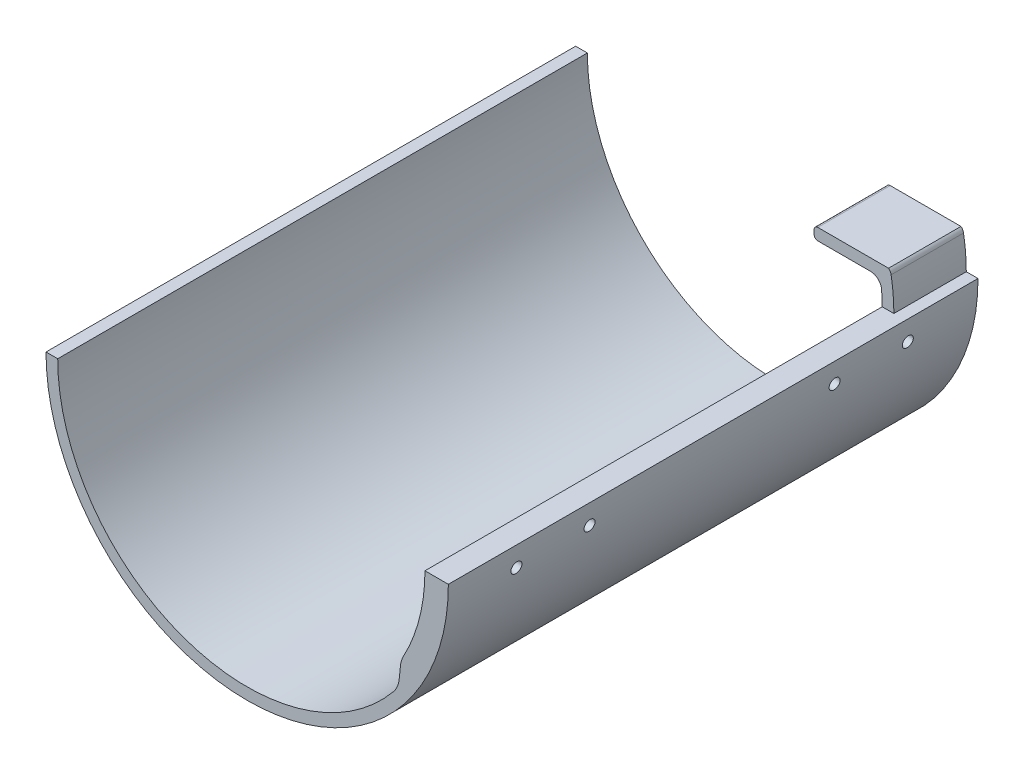
from build123d import *

# Parameters (mm, degrees)
EXTRUDE_1_DEPTH     = 144.8
SKETCH_7_R          = 1.5
CUT_EXTRUDE_6_DEPTH = 80
CUT_EXTRUDE_START   = -125
CUT_EXTRUDE_8_DEPTH = 125


with BuildPart() as part:
    # 草图1 → 凸台-拉伸1 (new body)
    with BuildSketch(Plane.XY):
        with BuildLine():
            Line((-55, 0), (-51.8, 0))
            ThreePointArc((-51.8, 0), (-17.476086779, -48.76296126), (40.00796876, -32.902924425))
            ThreePointArc((40.00796876, -32.902924425), (41.062164054, -31.150956215), (41.565129022, -29.16910189))
            Line((41.565129022, -29.16910189), (41.910264928, -25.795992674))
            ThreePointArc((41.910264928, -25.795992674), (42.185460224, -24.44340265), (42.720717667, -23.171108779))
            ThreePointArc((42.720717667, -23.171108779), (47.564735827, -9.977770578), (48.43095601, 4.05))
            ThreePointArc((48.43095601, 4.05), (47.472400425, 6.007940217), (45.441390824, 6.8))
            Line((45.441390824, 6.8), (31, 6.8))
            ThreePointArc((31, 6.8), (30.292893219, 7.092893219), (30, 7.8))
            Line((30, 7.8), (30, 9))
            ThreePointArc((30, 9), (30.292893219, 9.707106781), (31, 10))
            Line((31, 10), (50.344019583, 10))
            ThreePointArc((50.344019583, 10), (50.805346897, 9.459374484), (51.0484918, 8.791557597))
            ThreePointArc((51.0484918, 8.791557597), (51.611780996, 4.411809423), (51.8, 0))
            Line((51.8, 0), (55, 0))
            ThreePointArc((55, 0), (0, -55), (-55, 0))
        make_face()
    extrude(amount=EXTRUDE_1_DEPTH)

    # 草图7 → 切除-拉伸6 (cut)
    with BuildSketch(Plane(origin=(0, 0, 0), x_dir=(0.10066073352284005, 0.994920809274107, 0), z_dir=(-0.9949208092741069, 0.10066073352284004, 0))):
        with Locations(Location((-0.136340344, -18.9, 0), (0, 0, 180))):
            Circle(SKETCH_7_R)
        with Locations(Location((-0.136340344, -38.9, 0), (0, 0, 180))):
            Circle(SKETCH_7_R)
        with Locations(Location((-0.136340344, -105.9, 0), (0, 0, 180))):
            Circle(SKETCH_7_R)
        with Locations(Location((-0.136340344, -125.9, 0), (0, 0, 180))):
            Circle(SKETCH_7_R)
    extrude(amount=-CUT_EXTRUDE_6_DEPTH, mode=Mode.SUBTRACT)

    # 草图4 → 切除-拉伸8 (cut)
    with BuildSketch(Plane.XY.offset(144.8).offset(CUT_EXTRUDE_START)):
        with BuildLine():
            Line((55, 0), (0, 0))
            Line((0, 0), (50.016978469, 22.875792113))
            ThreePointArc((50.016978469, 22.875792113), (53.739807479, 11.70611345), (55, 0))
        make_face()
    extrude(amount=CUT_EXTRUDE_8_DEPTH, mode=Mode.SUBTRACT)


solid = part.part
